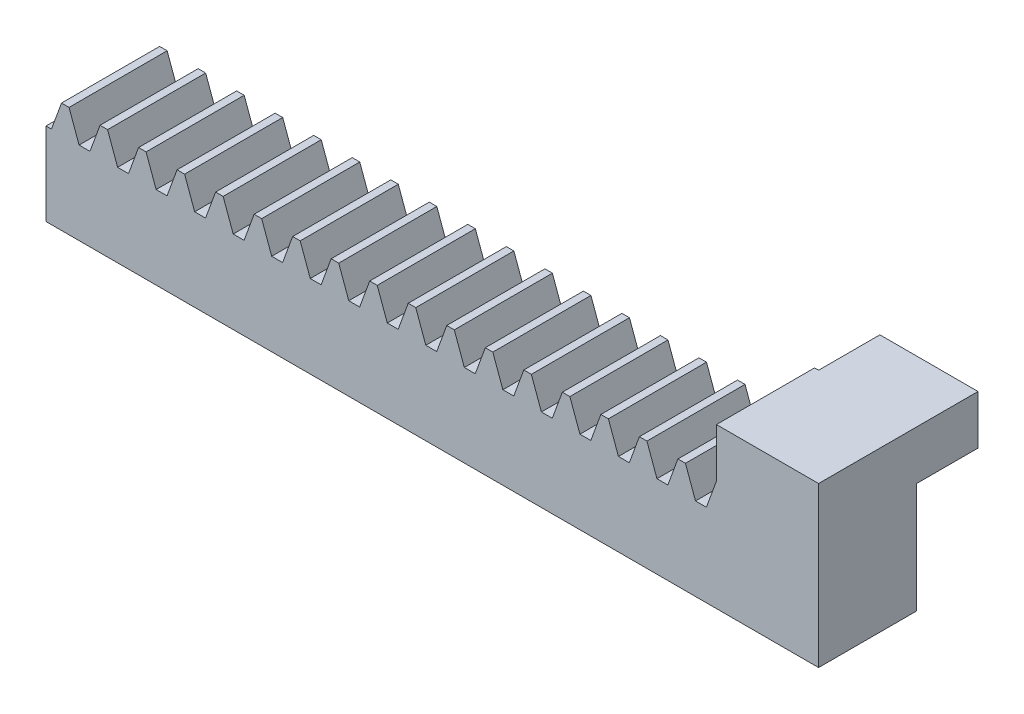
from build123d import *

# Parameters (mm, degrees)
BLANKSKE_W          = 55
BLANKSKE_H          = 9
BLANK_DEPTH         = 8
TOOTHCUTSIM_DEPTH   = 57.302753041
TEETHCUTS_COUNT     = 18
TEETHCUTS_PITCH     = 3.14159265
SKETCH1_W           = 8
SKETCH1_H           = 9
BOSS_EXTRUDE1_DEPTH = 8
SKETCH2_W           = 8.329556553
SKETCH2_H           = 8
BOSS_EXTRUDE2_DEPTH = 4
SKETCH3_W           = 8
SKETCH3_H           = 4
BOSS_EXTRUDE3_DEPTH = 5


with BuildPart() as part:
    # BlankSke → Blank (new body)
    with BuildSketch(Plane.XY):
        with Locations((27.5, 4.5)):
            Rectangle(BLANKSKE_W, BLANKSKE_H)
    extrude(amount=-BLANK_DEPTH)

    # TooCutSkeSim → ToothCutSim (cut, through all)
    with BuildSketch(Plane.XY):
        Polygon((0.44443537, 6.75), (-0.44443537, 6.75), (-1.272613241, 9.0254), (1.272613241, 9.0254), align=None)
    toothcutsim = extrude(amount=-TOOTHCUTSIM_DEPTH, mode=Mode.SUBTRACT)

    # TeethCuts: ToothCutSim ×18
    with Locations(*[(i * TEETHCUTS_PITCH, 0, 0) for i in range(1, TEETHCUTS_COUNT)]):
        add(toothcutsim, mode=Mode.SUBTRACT)

    # Sketch1 → Boss-Extrude1 (add)
    with BuildSketch(Plane(origin=(55, 0, 0), x_dir=(0, 0, -1), z_dir=(1, 0, 0))):
        with Locations((4, 4.5)):
            Rectangle(SKETCH1_W, SKETCH1_H)
    extrude(amount=BOSS_EXTRUDE1_DEPTH)

    # Sketch2 → Boss-Extrude2 (add)
    with BuildSketch(Plane(origin=(0, 9, 0), x_dir=(1, 0, 0), z_dir=(0, 1, 0))):
        with Locations((58.835221724, 4)):
            Rectangle(SKETCH2_W, SKETCH2_H)
    extrude(amount=BOSS_EXTRUDE2_DEPTH)

    # Sketch3 → Boss-Extrude3 (add)
    with BuildSketch(Plane(origin=(0, 0, -8), x_dir=(-1, 0, 0), z_dir=(0, 0, -1))):
        with Locations((-59, 11)):
            Rectangle(SKETCH3_W, SKETCH3_H)
    extrude(amount=BOSS_EXTRUDE3_DEPTH)


solid = part.part
